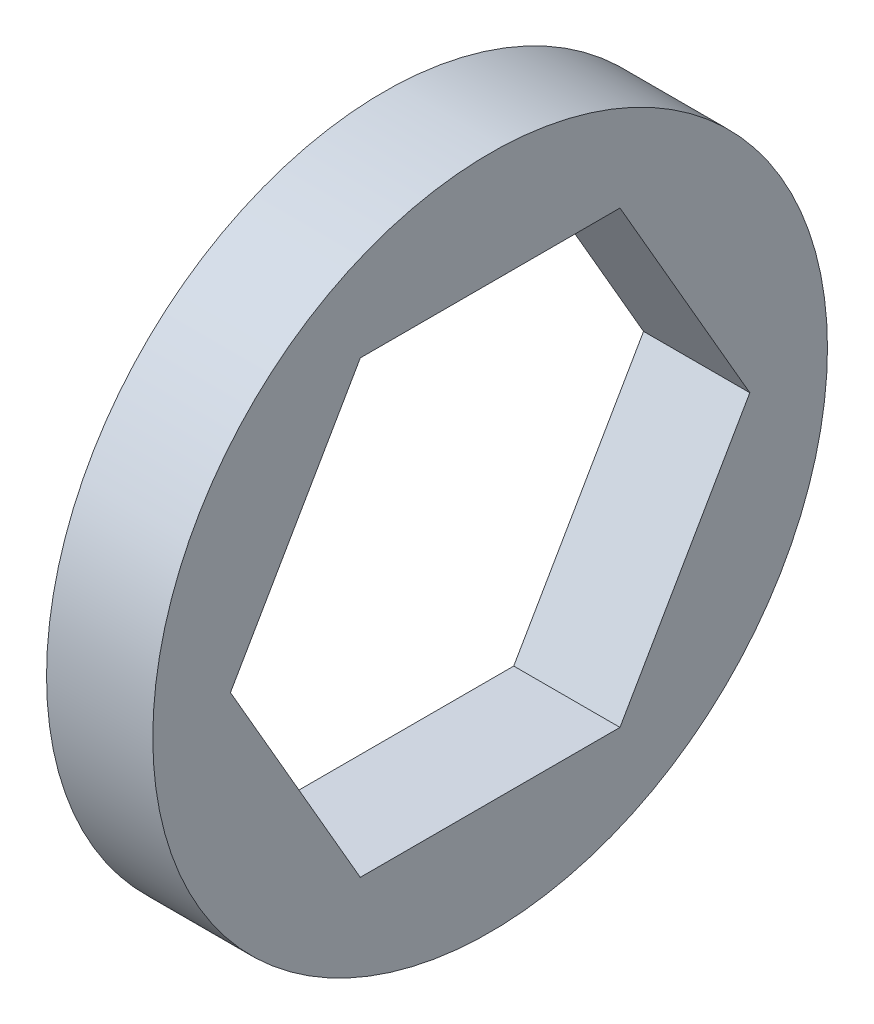
from build123d import *

# Parameters (mm, degrees)
SKETCH1_R           = 9.525
BOSS_EXTRUDE1_DEPTH = 1.5


with BuildPart() as part:
    # Sketch1 → Boss-Extrude1 (new, symmetric)
    with BuildSketch(Plane(origin=(0, 0, 0), x_dir=(0, 0, -1), z_dir=(1, 0, 0))):
        Circle(SKETCH1_R)
        Polygon((7.332348419, 0), (3.666174209, 6.35), (-3.666174209, 6.35), (-7.332348419, 0), (-3.666174209, -6.35), (3.666174209, -6.35), align=None, mode=Mode.SUBTRACT)
    extrude(amount=BOSS_EXTRUDE1_DEPTH, both=True)


solid = part.part
